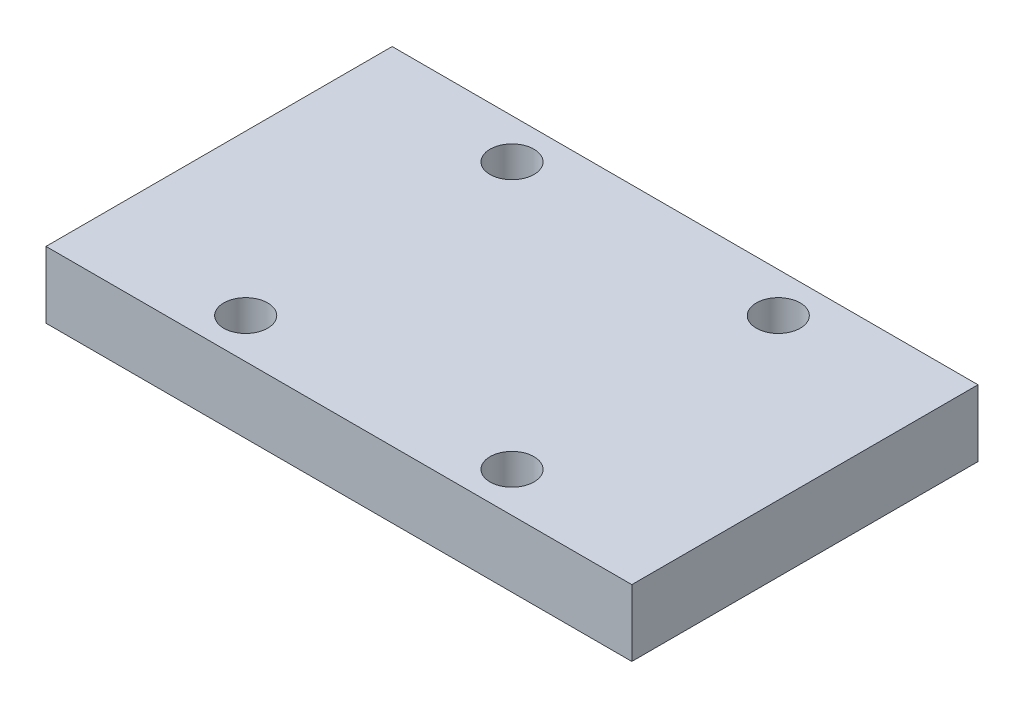
from build123d import *

# Parameters (mm, degrees)
SKETCH2_W           = 8.25
SKETCH2_H           = 8.25
SKETCH2_R           = 1.65
BOSS_EXTRUDE1_DEPTH = 5


with BuildPart() as part:
    # Sketch2 → Boss-Extrude1 (new body)
    # profile 1 of 5: a face of its own
    with BuildSketch(Plane(origin=(0, 0, 0), x_dir=(1, 0, 0), z_dir=(0, 1, 0))):
        with Locations((-10, 8.875)):
            Rectangle(SKETCH2_W, SKETCH2_H)
        with Locations(Location((-10, 10, 0), (0, 0, 270))):
            Circle(SKETCH2_R, mode=Mode.SUBTRACT)
    # profile 2 of 5: a face of its own
    with BuildSketch(Plane(origin=(0, 0, 0), x_dir=(1, 0, 0), z_dir=(0, 1, 0))):
        Polygon((-22, 13), (-22, -13), (-14.125, -13), (-14.125, -4.75), (-5.875, -4.75), (-5.875, -13), (5.875, -13), (5.875, -4.75), (14.125, -4.75), (14.125, -13), (22, -13), (22, 13), (14.125, 13), (14.125, 4.75), (5.875, 4.75), (5.875, 13), (-5.875, 13), (-5.875, 4.75), (-14.125, 4.75), (-14.125, 13), align=None)
    # profile 3 of 5: a face of its own
    with BuildSketch(Plane(origin=(0, 0, 0), x_dir=(1, 0, 0), z_dir=(0, 1, 0))):
        with Locations((10, 8.875)):
            Rectangle(SKETCH2_W, SKETCH2_H)
        with Locations(Location((10, 10, 0), (0, 0, 270))):
            Circle(SKETCH2_R, mode=Mode.SUBTRACT)
    # profile 4 of 5: a face of its own
    with BuildSketch(Plane(origin=(0, 0, 0), x_dir=(1, 0, 0), z_dir=(0, 1, 0))):
        with Locations((10, -8.875)):
            Rectangle(SKETCH2_W, SKETCH2_H)
        with Locations(Location((10, -10, 0), (0, 0, 270))):
            Circle(SKETCH2_R, mode=Mode.SUBTRACT)
    # profile 5 of 5: a face of its own
    with BuildSketch(Plane(origin=(0, 0, 0), x_dir=(1, 0, 0), z_dir=(0, 1, 0))):
        with Locations((-10, -8.875)):
            Rectangle(SKETCH2_W, SKETCH2_H)
        with Locations(Location((-10, -10, 0), (0, 0, 270))):
            Circle(SKETCH2_R, mode=Mode.SUBTRACT)
    extrude(amount=-BOSS_EXTRUDE1_DEPTH)


solid = part.part
